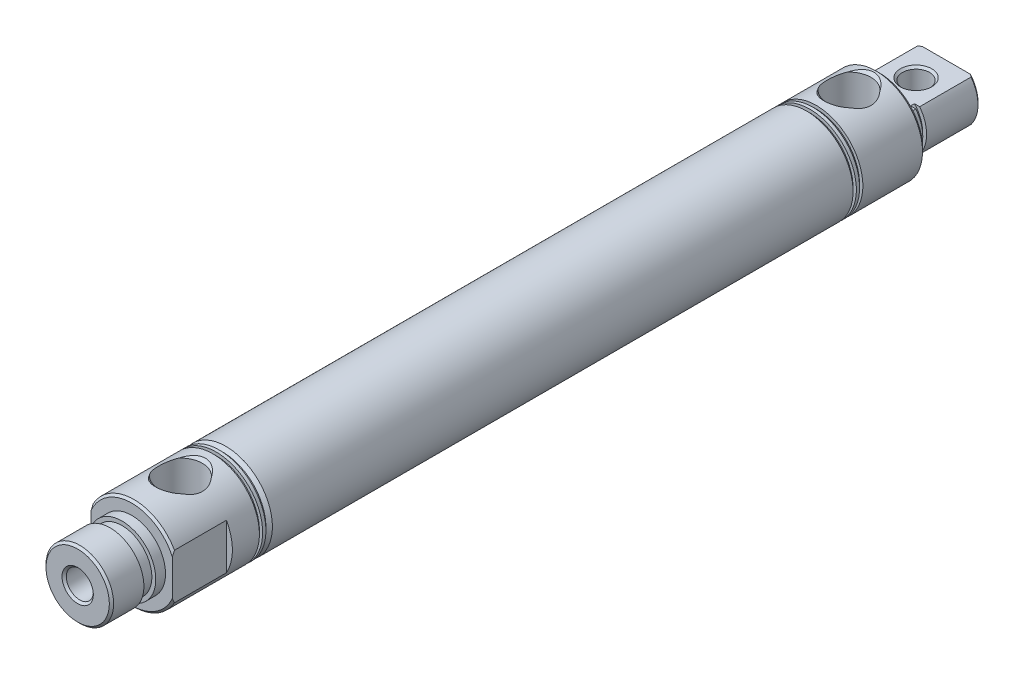
from build123d import *

# Parameters (mm, degrees)
EXTRUDE1_DEPTH      = 95.631
EXTRUDE1_DEPTH_BACK = 95.631
SKETCH1_R           = 10.922
SKETCH3_W           = 0.762
SKETCH3_H           = 0.762
RODHOLE_START       = -161.631
SKETCH8_R           = 3.175
RODHOLE_DEPTH       = 161.631
SKETCH9_R           = 9.525
STROKECHAMBER_DEPTH = 106.6
CHAMFER1_SIZE       = 0.5
FLATS_DEPTH         = 110.426622599
FLATS_DEPTH_BACK    = 110.426622599
SKETCH4_W           = 1.397
SKETCH4_H           = 12.7
SKETCH4_W_2         = 0.5
SKETCH4_H_2         = 3.048
ENDFLATS_DEPTH      = 110.426622599
ENDFLATS_DEPTH_BACK = 110.426622599
SKETCH12_W          = 6.096
SKETCH12_H          = 15.024


with BuildPart() as part:
    # Sketch1 → Extrude1 (new, two sides: drawn at the far end of the back side and taken through both)
    with BuildSketch(Plane.XY.offset(-EXTRUDE1_DEPTH_BACK)):
        Circle(SKETCH1_R)
    extrude(amount=EXTRUDE1_DEPTH + EXTRUDE1_DEPTH_BACK)

    # Sketch2 → Nose (revolve)
    with BuildSketch(Plane(origin=(0, 0, 0), x_dir=(0, 0, -1), z_dir=(1, 0, 0)), mode=Mode.PRIVATE) as nose_sk:
        Polygon((-95.631, 7.9248), (-97.917, 7.9248), (-97.917, 7), (-100.717, 7), (-100.717, 7.9375), (-108.331, 7.9375), (-108.331, 0), (-95.631, 0), align=None)
    revolve(nose_sk.sketch.rotate(Axis((0, 0, 0), (0, 0, 1)), 90), axis=Axis((0, 0, 0), (0, 0, 1)))

    # Sketch3 → CoverGrooves (revolve, cut)
    with BuildSketch(Plane(origin=(0, 0, 0), x_dir=(0, 0, -1), z_dir=(1, 0, 0)), mode=Mode.PRIVATE) as covergrooves_sk:
        with Locations((-76.2, 10.541)):
            Rectangle(SKETCH3_W, SKETCH3_H)
        Polygon((-75.057, 10.922), (-75.057, 10.16), (-74.295, 10.16), (-73.533, 10.922), align=None)
        Polygon((65.107, 10.922), (65.107, 10.16), (64.345, 10.922), align=None)
        Polygon((63.583, 10.922), (63.583, 10.16), (62.821, 10.922), align=None)
    revolve(covergrooves_sk.sketch.rotate(Axis((0, 0, 0), (0, 0, 1)), 90), axis=Axis((0, 0, 0), (0, 0, 1)), mode=Mode.SUBTRACT)

    # Sketch7 → FrontPort (revolve, cut)
    with BuildSketch(Plane(origin=(0, 0, 0), x_dir=(0, 0, -1), z_dir=(1, 0, 0))):
        Polygon((-84.201, 10.922), (-78.351, 10.922), (-79.051, 10.222), (-79.051, 0), (-84.201, 0), align=None)
    revolve(axis=Axis((0, 0, 84.201), (0, 1, 0)), mode=Mode.SUBTRACT)

    # Sketch8 → RodHole (cut)
    with BuildSketch(Plane.XY.offset(108.331).offset(RODHOLE_START)):
        Circle(SKETCH8_R)
    extrude(amount=RODHOLE_DEPTH, mode=Mode.SUBTRACT)

    # Sketch9 → StrokeChamber (cut)
    with BuildSketch(Plane.XY.offset(-53.3)):
        Circle(SKETCH9_R)
    extrude(amount=STROKECHAMBER_DEPTH, mode=Mode.SUBTRACT)

    # Chamfer1
    chamfer1_edges = [part.edges().sort_by_distance(p)[0] for p in [
        (-10.922, 0, -95.631),
        (-3.175, 0, 108.331),
        (-10.922, 0, 95.631),
        (7.9375, 0, 108.331),
    ]]
    chamfer(chamfer1_edges, length=CHAMFER1_SIZE)

    # Sketch4 → Flats (cut, two sides: drawn at the far end of the back side and taken through both)
    with BuildSketch(Plane(origin=(0, 0, 0), x_dir=(1, 0, 0), z_dir=(0, 1, 0)).offset(-FLATS_DEPTH_BACK)):
        with Locations((10.2235, -89.281)):
            Rectangle(SKETCH4_W, SKETCH4_H)
        with Locations((10.672, 94.107)):
            Rectangle(SKETCH4_W_2, SKETCH4_H_2)
        with Locations((-10.672, 94.107)):
            Rectangle(SKETCH4_W_2, SKETCH4_H_2)
        with Locations((-10.2235, -89.281)):
            Rectangle(SKETCH4_W, SKETCH4_H)
    extrude(amount=FLATS_DEPTH + FLATS_DEPTH_BACK, mode=Mode.SUBTRACT)

    # Sketch11 → EndThreads (revolve, cut)
    with BuildSketch(Plane(origin=(0, 0, 0), x_dir=(0, 0, -1), z_dir=(1, 0, 0)), mode=Mode.PRIVATE) as endthreads_sk:
        Polygon((95.631, 7.4375), (95.131, 7.9375), (83.07, 7.9375), (83.07, 7), (82.169, 7), (82.169, 7.9375), (79.883, 7.9375), (79.883, 10.16), (79.121, 10.922), (95.631, 10.922), align=None)
    revolve(endthreads_sk.sketch.rotate(Axis((0, 0, 0), (0, 0, -1)), 90), axis=Axis((0, 0, 0), (0, 0, -1)), mode=Mode.SUBTRACT)

    # Sketch13 → RearTopPort (revolve, cut)
    with BuildSketch(Plane(origin=(0, 0, 0), x_dir=(0, 0, -1), z_dir=(1, 0, 0))):
        Polygon((72.771, 0), (77.921, 0), (77.921, 10.222), (78.621, 10.922), (72.771, 10.922), align=None)
    revolve(axis=Axis((0, 0, -72.771), (0, 1, 0)), mode=Mode.SUBTRACT)

    # Sketch12 → EndFlats (cut, two sides: drawn at the far end of the back side and taken through both)
    with BuildSketch(Plane(origin=(0, 0, 0), x_dir=(0, -1, 0), z_dir=(1, 0, 0)).offset(-ENDFLATS_DEPTH_BACK)):
        with Locations((7.874, 88.119)):
            Rectangle(SKETCH12_W, SKETCH12_H)
        with Locations((-7.874, 88.119)):
            Rectangle(SKETCH12_W, SKETCH12_H)
    extrude(amount=ENDFLATS_DEPTH + ENDFLATS_DEPTH_BACK, mode=Mode.SUBTRACT)

    # Sketch15 → ClevisPinHole (revolve, cut)
    with BuildSketch(Plane(origin=(0, 0, 0), x_dir=(0, -1, 0), z_dir=(1, 0, 0)), mode=Mode.PRIVATE) as clevispinhole_sk:
        Polygon((4.826, 92.2067), (4.326, 91.7067), (-4.326, 91.7067), (-4.826, 92.2067), (-4.826, 88.519), (4.826, 88.519), align=None)
    revolve(clevispinhole_sk.sketch.rotate(Axis((0, 0, -88.519), (0, -1, 0)), 180), axis=Axis((0, 0, -88.519), (0, -1, 0)), mode=Mode.SUBTRACT)


solid = part.part
